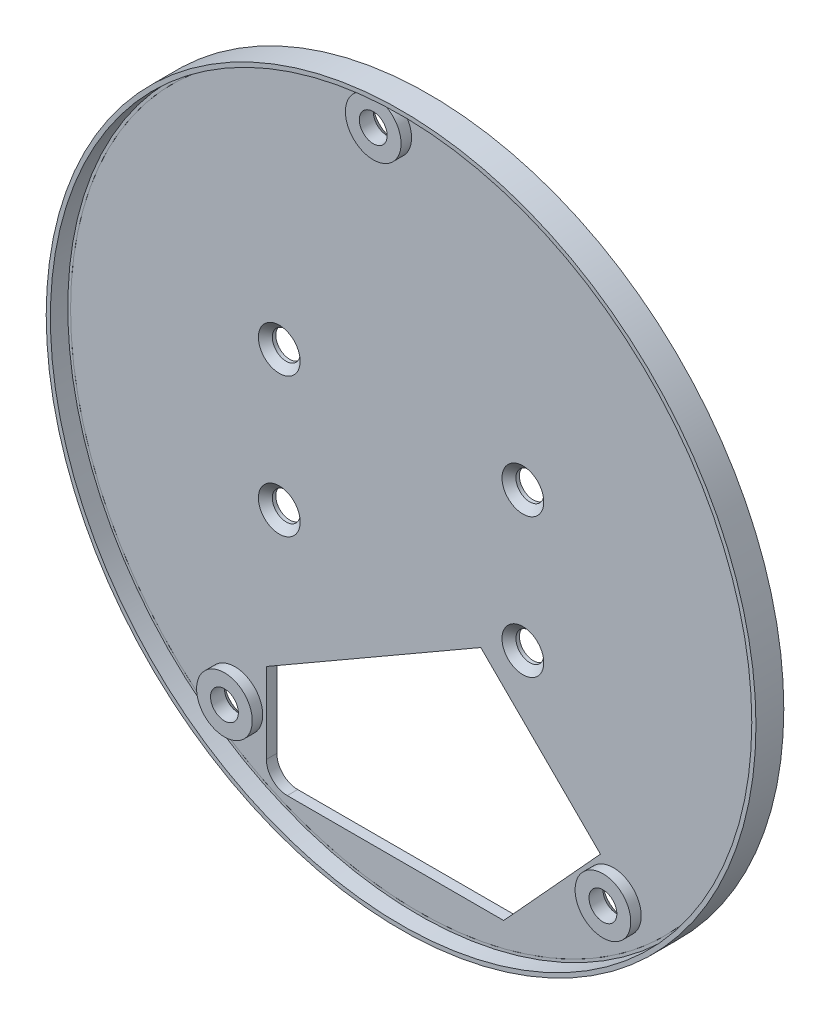
from build123d import *

# Parameters (mm, degrees)
SKETCH1_R             = 4
SKETCH1_R_2           = 2.00000381
BOSS_EXTRUDE1_DEPTH   = 1.5
BOSS_EXTRUDE1_2_DEPTH = 1.5
SKETCH1_R_3           = 2
BOSS_EXTRUDE1_3_DEPTH = 1.5
SKETCH2_R             = 49.987399035
BOSS_EXTRUDE2_DEPTH   = 1.5
CUT_EXTRUDE1_REACH    = 171.433
SKETCH3_R             = 2
SKETCH3_R_2           = 2.00000381
CHAMFER1_SIZE         = 1
CUT_EXTRUDE7_REACH    = 171.453
SKETCH5_R             = 50.987399035
SKETCH5_R_2           = 49.987399035
BOSS_EXTRUDE3_DEPTH   = 4
SKETCH6_R             = 50.387399035
SKETCH6_R_2           = 49.909599328
CUT_EXTRUDE8_DEPTH    = 2.5
SKETCH7_R             = 2
CUT_EXTRUDE9_DEPTH    = 1.5
CHAMFER2_SIZE         = 1


with BuildPart() as part:
    # Sketch1 → Boss-Extrude1 (new body)
    with BuildSketch(Plane(origin=(0, 0, 0), x_dir=(-1, 0, 0), z_dir=(0, 0, -1))):
        with Locations((15.924275789, 71.610816006)):
            Circle(SKETCH1_R)
        with Locations((15.924275789, 71.610816006)):
            Circle(SKETCH1_R_2, mode=Mode.SUBTRACT)
    extrude(amount=BOSS_EXTRUDE1_DEPTH)



with BuildPart() as body_2:
    # Sketch1 → Boss-Extrude1 2 (new body)
    with BuildSketch(Plane(origin=(0, 0, 0), x_dir=(-1, 0, 0), z_dir=(0, 0, -1))):
        with Locations((-38.455833431, 73.790821086)):
            Circle(SKETCH1_R)
        with Locations((-38.455833431, 73.790821086)):
            Circle(SKETCH1_R_2, mode=Mode.SUBTRACT)
    extrude(amount=BOSS_EXTRUDE1_2_DEPTH)


with BuildPart() as body_3:
    # Sketch1 → Boss-Extrude1 3 (new body)
    with BuildSketch(Plane(origin=(0, 0, 0), x_dir=(-1, 0, 0), z_dir=(0, 0, -1))):
        with Locations((-5.455767391, 154.110981107)):
            Circle(SKETCH1_R)
        with Locations((-5.455767391, 154.110981107)):
            Circle(SKETCH1_R_3, mode=Mode.SUBTRACT)
    extrude(amount=BOSS_EXTRUDE1_3_DEPTH)


with BuildPart() as part_1:
    add(part.part)

    add(body_2.part)  # Boss-Extrude2 merges body 2

    add(body_3.part)  # Boss-Extrude2 merges body 3
    # Sketch2 → Boss-Extrude2 (add)
    with BuildSketch(Plane(origin=(0, 0, -1.5), x_dir=(-1, 0, 0), z_dir=(0, 0, -1))):
        with Locations(Location((-10.455777551, 108.290889666, 0), (0, 0, 84.857617519))):
            Circle(SKETCH2_R)
    extrude(amount=BOSS_EXTRUDE2_DEPTH)

    # Sketch3 → Cut-Extrude1 (cut, up to next)
    with BuildSketch(Plane.XY.offset(-1.5), mode=Mode.PRIVATE) as cut_extrude1_sk1:
        with Locations(Location((5.455767391, 154.110981107, 0), (0, 0, 180))):
            Circle(SKETCH3_R)
    cut_extrude1_tool1 = extrude(cut_extrude1_sk1.sketch, amount=-CUT_EXTRUDE1_REACH, mode=Mode.PRIVATE) & part_1.part
    # Sketch3 → Cut-Extrude1 (cut, up to next)
    with BuildSketch(Plane.XY.offset(-1.5), mode=Mode.PRIVATE) as cut_extrude1_sk2:
        with Locations(Location((-15.924275789, 71.610816006, 0), (0, 0, 180))):
            Circle(SKETCH3_R_2)
    cut_extrude1_tool2 = extrude(cut_extrude1_sk2.sketch, amount=-CUT_EXTRUDE1_REACH, mode=Mode.PRIVATE) & part_1.part
    # Sketch3 → Cut-Extrude1 (cut, up to next)
    with BuildSketch(Plane.XY.offset(-1.5), mode=Mode.PRIVATE) as cut_extrude1_sk3:
        with Locations(Location((38.455833431, 73.790821086, 0), (0, 0, 180))):
            Circle(SKETCH3_R_2)
    cut_extrude1_tool3 = extrude(cut_extrude1_sk3.sketch, amount=-CUT_EXTRUDE1_REACH, mode=Mode.PRIVATE) & part_1.part
    add(cut_extrude1_tool1.solids().sort_by_distance((5.455767, 154.110981, -1.5))[0], mode=Mode.SUBTRACT)
    add(cut_extrude1_tool2.solids().sort_by_distance((-15.924276, 71.610816, -1.5))[0], mode=Mode.SUBTRACT)
    add(cut_extrude1_tool3.solids().sort_by_distance((38.455833, 73.790821, -1.5))[0], mode=Mode.SUBTRACT)

    # Chamfer1
    chamfer1_edges = [part_1.edges().sort_by_distance(p)[0] for p in [
        (7.455767391, 154.110981107, -3),
        (-13.924271979, 71.610816006, -3),
        (40.455837241, 73.790821086, -3),
    ]]
    chamfer(chamfer1_edges, length=CHAMFER1_SIZE)

    # Sketch4 → Cut-Extrude7 (cut, up to next)
    with BuildSketch(Plane(origin=(0, 0, -3), x_dir=(-1, 0, 0), z_dir=(0, 0, -1)), mode=Mode.PRIVATE) as cut_extrude7_sk1:
        with BuildLine():
            Line((-36.598932893, 78.543247745), (-19.408853497, 95.653922432))
            Line((-19.408853497, 95.653922432), (11.396229527, 77.89280991))
            Line((11.396229527, 77.89280991), (11.396229527, 66.33279975))
            ThreePointArc((11.396229527, 66.33279975), (10.517549871, 64.211479407), (8.396229527, 63.33279975))
            Line((8.396229527, 63.33279975), (1.609246579, 63.33279975))
            Line((1.609246579, 63.33279975), (-22.692379024, 63.33279975))
            Line((-22.692379024, 63.33279975), (-36.598932893, 78.543247745))
        make_face()
    cut_extrude7_tool1 = extrude(cut_extrude7_sk1.sketch, amount=-CUT_EXTRUDE7_REACH, mode=Mode.PRIVATE) & part_1.part
    add(cut_extrude7_tool1.solids().sort_by_distance((11.68885, 76.427285, -3))[0], mode=Mode.SUBTRACT)


with BuildPart() as body_2_2:
    # Sketch5 → Boss-Extrude3 (new body)
    with BuildSketch(Plane(origin=(5.822978124, 110.39290389, -3), x_dir=(1, 0, 0), z_dir=(0, 0, 1))):
        with Locations((4.632799428, -2.102014224)):
            Circle(SKETCH5_R)
        with Locations((4.632799428, -2.102014224)):
            Circle(SKETCH5_R_2, mode=Mode.SUBTRACT)
    extrude(amount=BOSS_EXTRUDE3_DEPTH)


with BuildPart() as cut_extrude8_tool:
    # Sketch6 → Cut-Extrude8 (new body)
    with BuildSketch(Plane.XY.offset(1)):
        with Locations((10.455777551, 108.290889666)):
            Circle(SKETCH6_R)
        with Locations((10.455777551, 108.290889666)):
            Circle(SKETCH6_R_2, mode=Mode.SUBTRACT)
    extrude(amount=-CUT_EXTRUDE8_DEPTH)


with BuildPart() as part_2:
    add(part_1.part)

    # Cut-Extrude8: cut by cut_extrude8_tool
    add(cut_extrude8_tool.part, mode=Mode.SUBTRACT)

    # Sketch7 → Cut-Extrude9 (cut)
    with BuildSketch(Plane(origin=(0, 0, -3), x_dir=(-1, 0, 0), z_dir=(0, 0, -1))):
        with Locations((-25.455777551, 98.290889666)):
            Circle(SKETCH7_R)
        with Locations((9.544222449, 98.290889666)):
            Circle(SKETCH7_R)
        with Locations((-25.455777551, 118.290889666)):
            Circle(SKETCH7_R)
        with Locations((9.544222449, 118.290889666)):
            Circle(SKETCH7_R)
    extrude(amount=-CUT_EXTRUDE9_DEPTH, mode=Mode.SUBTRACT)

    # Chamfer2
    chamfer2_edges = [part_2.edges().sort_by_distance(p)[0] for p in [
        (-7.544222449, 98.290889666, -1.5),
        (27.455777551, 118.290889666, -1.5),
        (-7.544222449, 118.290889666, -1.5),
        (27.455777551, 98.290889666, -1.5),
    ]]
    chamfer(chamfer2_edges, length=CHAMFER2_SIZE)


with BuildPart() as body_2_2_1:
    add(body_2_2.part)

    # Cut-Extrude8: cut by cut_extrude8_tool
    add(cut_extrude8_tool.part, mode=Mode.SUBTRACT)


solid = Compound([part_2.part, body_2_2_1.part])
